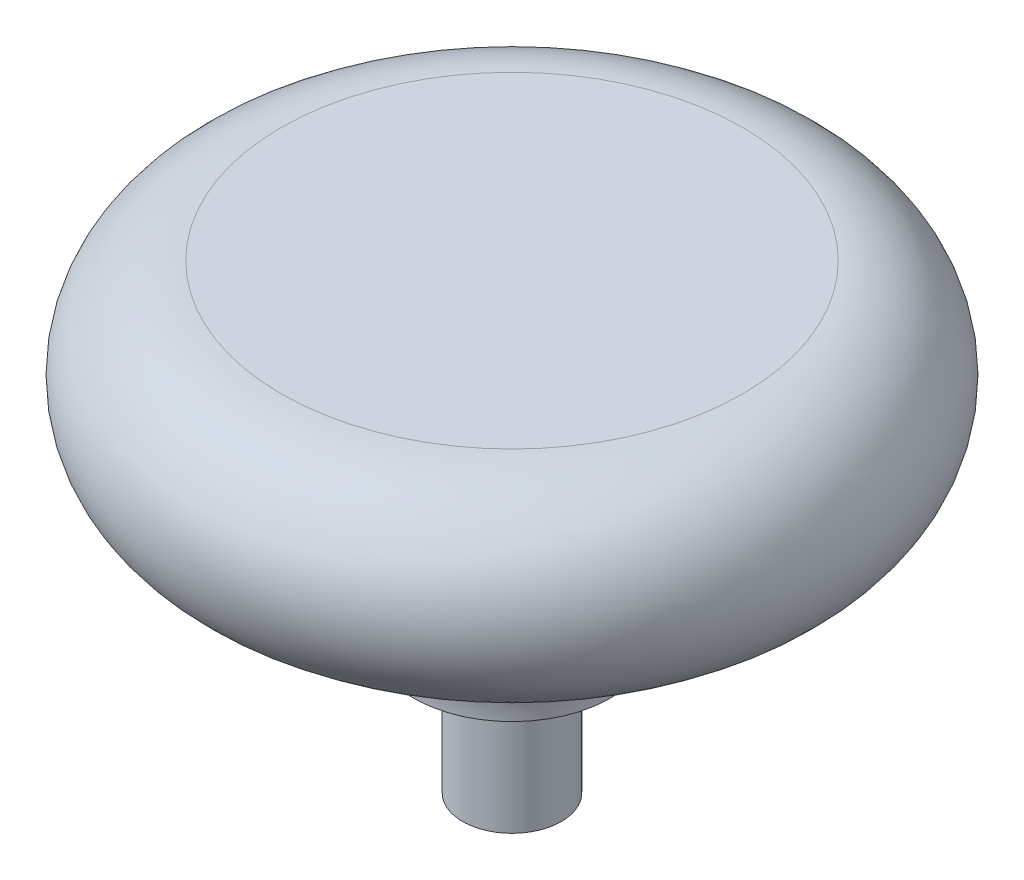
from build123d import *


with BuildPart() as part:
    # Sketch1 → Revolve1 (revolve)
    with BuildSketch(Plane.XY, mode=Mode.PRIVATE) as revolve1_sk:
        with BuildLine():
            Line((2.38, 0), (2.38, 6.35))
            Line((2.38, 6.35), (4.765, 6.35))
            ThreePointArc((4.765, 6.35), (6.625882433, 10.841138327), (11.117857786, 12.699999357))
            ThreePointArc((11.117857786, 12.699999357), (15.879999879, 17.458927768), (11.12, 22.219998875))
            Line((11.12, 22.219998875), (0, 22.219998875))
            Line((0, 22.219998875), (0, 0))
            Line((0, 0), (2.38, 0))
        make_face()
    revolve(revolve1_sk.sketch.rotate(Axis((0, 0, 0), (0, 1, 0)), 90), axis=Axis((0, 0, 0), (0, 1, 0)))


solid = part.part
